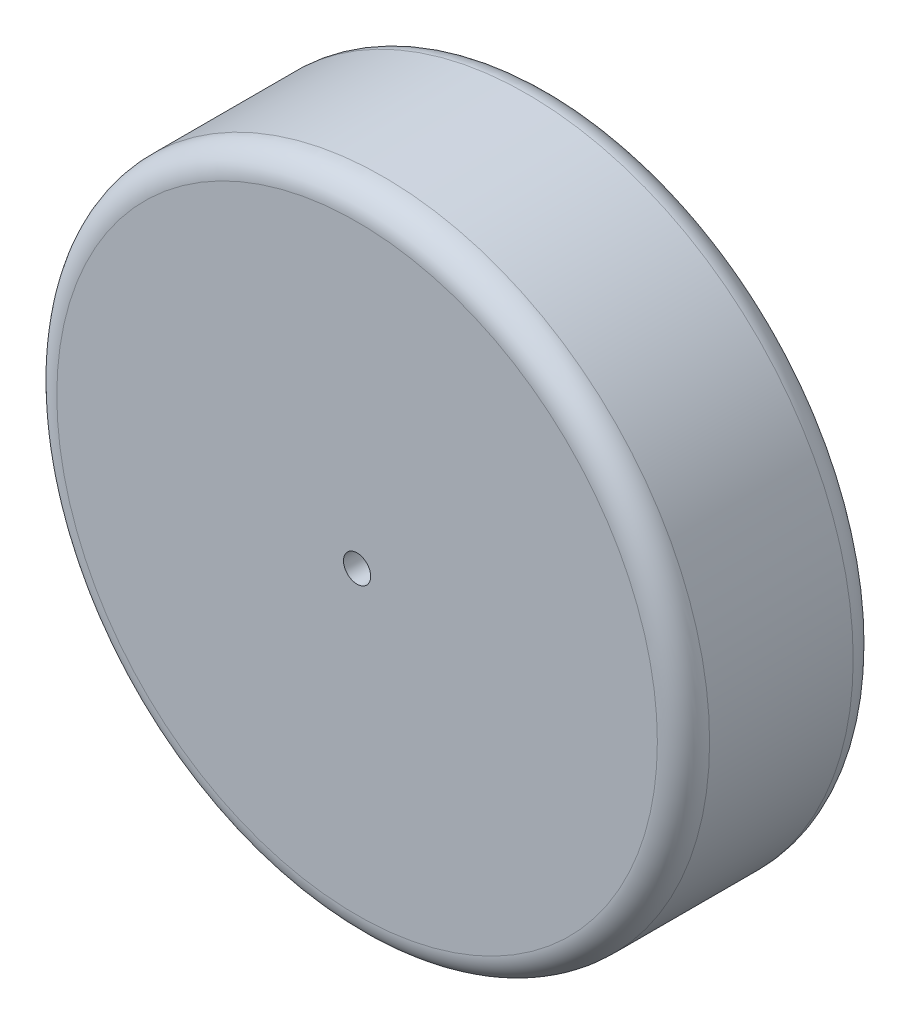
from build123d import *

# Parameters (mm, degrees)
SKETCH1_R           = 25
BOSS_EXTRUDE1_DEPTH = 15
FILLET1_R           = 2
SKETCH7_R           = 1.04
CUT_EXTRUDE2_DEPTH  = 39.405728804


with BuildPart() as part:
    # Sketch1 → Boss-Extrude1 (new body)
    with BuildSketch(Plane.XY):
        Circle(SKETCH1_R)
    extrude(amount=BOSS_EXTRUDE1_DEPTH)

    # Fillet1
    fillet1_edges = [part.edges().sort_by_distance(p)[0] for p in [
        (-25, 0, 0),
        (-25, 0, 15),
    ]]
    fillet(fillet1_edges, radius=FILLET1_R)

    # Sketch7 → Cut-Extrude2 (cut, through all)
    with BuildSketch(Plane.XY.offset(15)):
        Circle(SKETCH7_R)
    extrude(amount=-CUT_EXTRUDE2_DEPTH, mode=Mode.SUBTRACT)


solid = part.part
